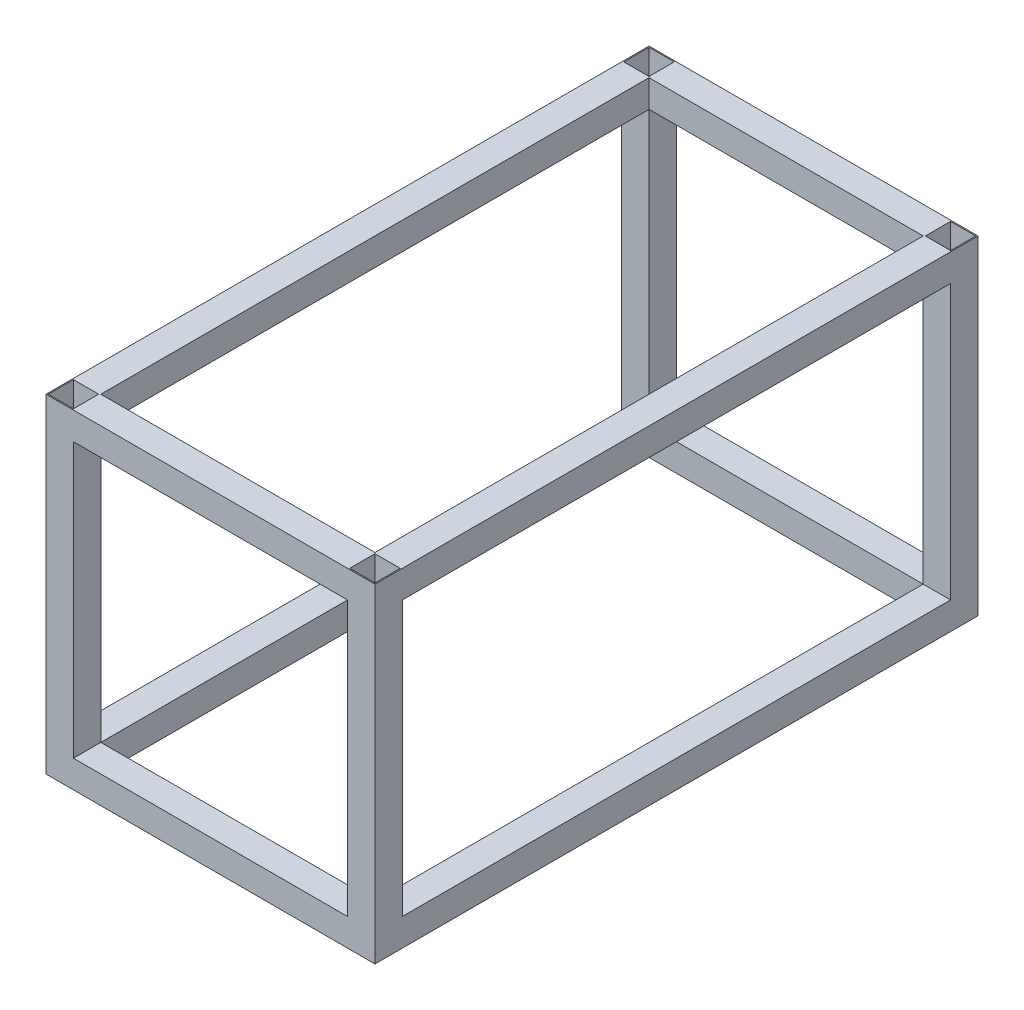
from build123d import *

# Parameters (mm, degrees)
SKETCH1_W             = 25.4
SKETCH1_H             = 25.4
SKETCH1_W_2           = 23.4
SKETCH1_H_2           = 23.4
BOSS_EXTRUDE1_DEPTH   = 304.8
BOSS_EXTRUDE1_2_DEPTH = 304.8
BOSS_EXTRUDE1_3_DEPTH = 304.8
BOSS_EXTRUDE1_4_DEPTH = 304.8
SKETCH2_W             = 25.4
SKETCH2_H             = 25.4
SKETCH2_W_2           = 23.4
SKETCH2_H_2           = 23.4
BOSS_EXTRUDE2_DEPTH   = 508
SKETCH3_W             = 25.4
SKETCH3_H             = 25.4
SKETCH3_W_2           = 23.4
SKETCH3_H_2           = 23.4
BOSS_EXTRUDE4_DEPTH   = 254
LPATTERN2_COUNT       = 2
LPATTERN2_PITCH       = 279.4


with BuildPart() as part:
    # Sketch1 → Boss-Extrude1 (new body)
    with BuildSketch(Plane(origin=(0, 0, 0), x_dir=(1, 0, 0), z_dir=(0, 1, 0))):
        with Locations((139.7, 266.7)):
            Rectangle(SKETCH1_W, SKETCH1_H)
        with Locations((139.7, 266.7)):
            Rectangle(SKETCH1_W_2, SKETCH1_H_2, mode=Mode.SUBTRACT)
    extrude(amount=BOSS_EXTRUDE1_DEPTH)



with BuildPart() as body_2:
    # Sketch1 → Boss-Extrude1 2 (new body)
    with BuildSketch(Plane(origin=(0, 0, 0), x_dir=(1, 0, 0), z_dir=(0, 1, 0))):
        with Locations((139.7, -266.7)):
            Rectangle(SKETCH1_W, SKETCH1_H)
        with Locations((139.7, -266.7)):
            Rectangle(SKETCH1_W_2, SKETCH1_H_2, mode=Mode.SUBTRACT)
    extrude(amount=BOSS_EXTRUDE1_2_DEPTH)


with BuildPart() as body_3:
    # Sketch1 → Boss-Extrude1 3 (new body)
    with BuildSketch(Plane(origin=(0, 0, 0), x_dir=(1, 0, 0), z_dir=(0, 1, 0))):
        with Locations((-139.7, -266.7)):
            Rectangle(SKETCH1_W, SKETCH1_H)
        with Locations((-139.7, -266.7)):
            Rectangle(SKETCH1_W_2, SKETCH1_H_2, mode=Mode.SUBTRACT)
    extrude(amount=BOSS_EXTRUDE1_3_DEPTH)


with BuildPart() as body_4:
    # Sketch1 → Boss-Extrude1 4 (new body)
    with BuildSketch(Plane(origin=(0, 0, 0), x_dir=(1, 0, 0), z_dir=(0, 1, 0))):
        with Locations((-139.7, 266.7)):
            Rectangle(SKETCH1_W, SKETCH1_H)
        with Locations((-139.7, 266.7)):
            Rectangle(SKETCH1_W_2, SKETCH1_H_2, mode=Mode.SUBTRACT)
    extrude(amount=BOSS_EXTRUDE1_4_DEPTH)


with BuildPart() as part_1:
    add(part.part)

    add(body_2.part)  # Boss-Extrude2 merges body 2
    # Sketch2 → Boss-Extrude2 (add)
    # profile 1 of 2: a face of its own
    with BuildSketch(Plane.XY.offset(-254)):
        with Locations((139.7, 292.1)):
            Rectangle(SKETCH2_W, SKETCH2_H)
        with Locations((139.7, 292.1)):
            Rectangle(SKETCH2_W_2, SKETCH2_H_2, mode=Mode.SUBTRACT)
    # profile 2 of 2: a face of its own
    with BuildSketch(Plane.XY.offset(-254)):
        with Locations((139.7, 12.7)):
            Rectangle(SKETCH2_W, SKETCH2_H)
        with Locations((139.7, 12.7)):
            Rectangle(SKETCH2_W_2, SKETCH2_H_2, mode=Mode.SUBTRACT)
    boss_extrude2 = extrude(amount=BOSS_EXTRUDE2_DEPTH)


    add(body_3.part)  # Boss-Extrude4 merges body 3

    add(body_4.part)  # Boss-Extrude4 merges body 4
    # Sketch3 → Boss-Extrude4 (add)
    # profile 1 of 4: a face of its own
    with BuildSketch(Plane.ZY.offset(-127)):
        with Locations((266.7, 292.1)):
            Rectangle(SKETCH3_W, SKETCH3_H)
        with Locations((266.7, 292.1)):
            Rectangle(SKETCH3_W_2, SKETCH3_H_2, mode=Mode.SUBTRACT)
    # profile 2 of 4: a face of its own
    with BuildSketch(Plane.ZY.offset(-127)):
        with Locations((-266.7, 292.1)):
            Rectangle(SKETCH3_W, SKETCH3_H)
        with Locations((-266.7, 292.1)):
            Rectangle(SKETCH3_W_2, SKETCH3_H_2, mode=Mode.SUBTRACT)
    # profile 3 of 4: a face of its own
    with BuildSketch(Plane.ZY.offset(-127)):
        with Locations((266.7, 12.7)):
            Rectangle(SKETCH3_W, SKETCH3_H)
        with Locations((266.7, 12.7)):
            Rectangle(SKETCH3_W_2, SKETCH3_H_2, mode=Mode.SUBTRACT)
    # profile 4 of 4: a face of its own
    with BuildSketch(Plane.ZY.offset(-127)):
        with Locations((-266.7, 12.7)):
            Rectangle(SKETCH3_W, SKETCH3_H)
        with Locations((-266.7, 12.7)):
            Rectangle(SKETCH3_W_2, SKETCH3_H_2, mode=Mode.SUBTRACT)
    extrude(amount=BOSS_EXTRUDE4_DEPTH)

    # LPattern2: Boss-Extrude2 ×2
    with Locations(*[(-i * LPATTERN2_PITCH, 0, 0) for i in range(1, LPATTERN2_COUNT)]):
        add(boss_extrude2)


solid = part_1.part
